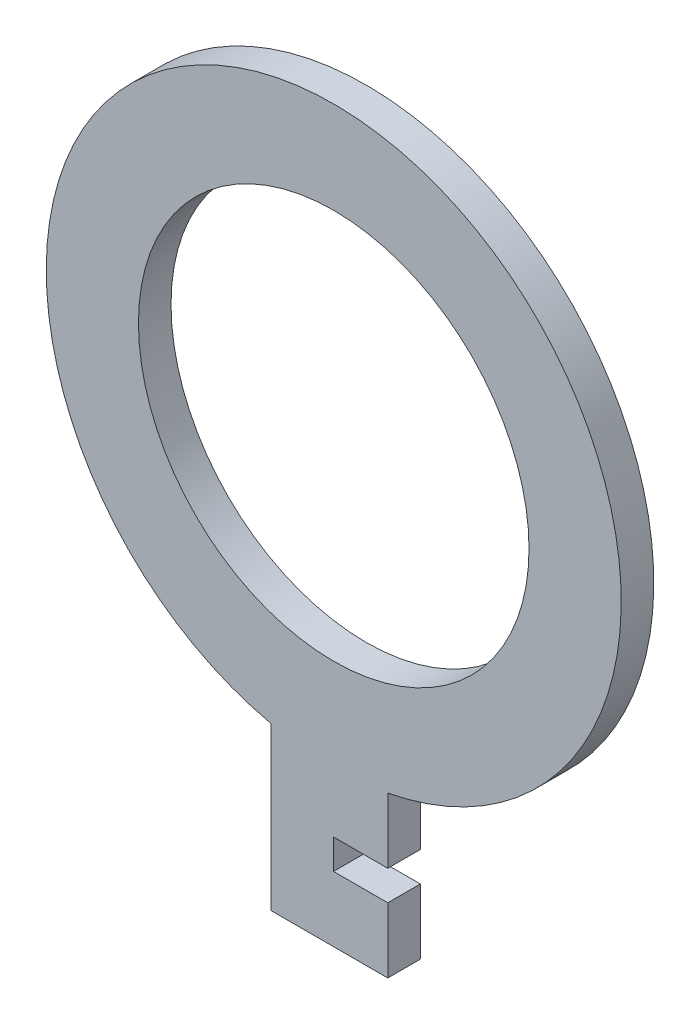
from build123d import *

# Parameters (mm, degrees)
CROQUIS1_R              = 17.985951022
SALIENTE_EXTRUIR1_DEPTH = 3


with BuildPart() as part:
    # Croquis1 → Saliente-Extruir1 (new body)
    with BuildSketch(Plane.XY):
        with BuildLine():
            Line((69.938444675, 17.671179984), (59.198401062, 17.671179984))
            Line((59.198401062, 17.671179984), (59.198401062, 32.584255723))
            ThreePointArc((59.198401062, 32.584255723), (65.364018559, 84.900042365), (69.938444675, 32.421179984))
            Line((69.938444675, 32.421179984), (69.938444675, 26.421179984))
            Line((69.938444675, 26.421179984), (64.938444675, 26.421179984))
            Line((64.938444675, 26.421179984), (64.938444675, 23.671179984))
            Line((64.938444675, 23.671179984), (69.938444675, 23.671179984))
            Line((69.938444675, 23.671179984), (69.938444675, 17.671179984))
        make_face()
        with Locations((64.962042446, 58.426202565)):
            Circle(CROQUIS1_R, mode=Mode.SUBTRACT)
    extrude(amount=SALIENTE_EXTRUIR1_DEPTH)


solid = part.part
